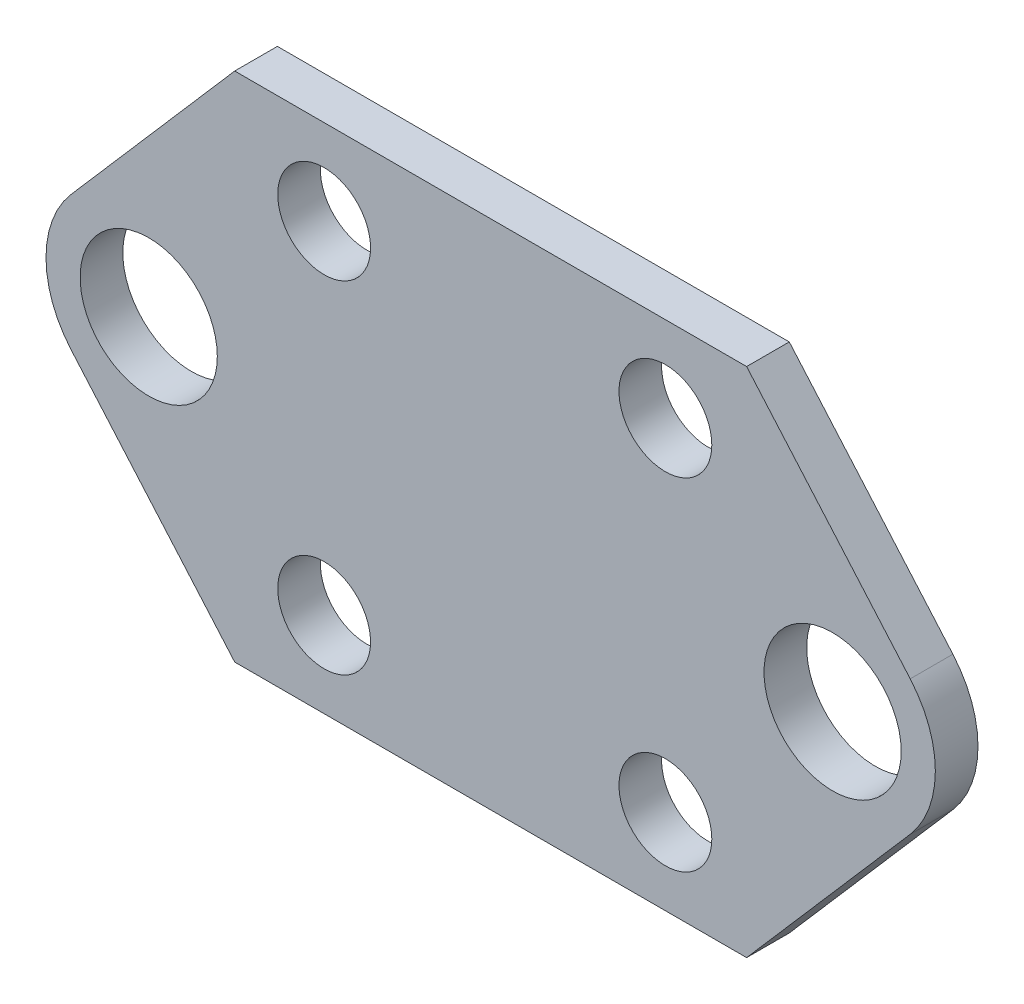
from build123d import *

# Parameters (mm, degrees)
CROQUIS1_R              = 1.7272
CROQUIS1_R_2            = 2.5527
SALIENTE_EXTRUIR1_DEPTH = 0.79375


with BuildPart() as part:
    # Croquis1 → Saliente-Extruir1 (new, symmetric)
    with BuildSketch(Plane.XY):
        with BuildLine():
            ThreePointArc((-15.613365943, 2.50453349), (-16.5481, 0), (-15.613365943, -2.50453349))
            Line((-15.613365943, -2.50453349), (-9.525, -9.525))
            Line((-9.525, -9.525), (9.525, -9.525))
            Line((9.525, -9.525), (15.613365943, -2.50453349))
            ThreePointArc((15.613365943, -2.50453349), (16.5481, 0), (15.613365943, 2.50453349))
            Line((15.613365943, 2.50453349), (9.525, 9.525))
            Line((9.525, 9.525), (-9.525, 9.525))
            Line((-9.525, 9.525), (-15.613365943, 2.50453349))
        make_face()
        with Locations((-6.1976, -6.35)):
            Circle(CROQUIS1_R, mode=Mode.SUBTRACT)
        with Locations((6.5024, -6.35)):
            Circle(CROQUIS1_R, mode=Mode.SUBTRACT)
        with Locations((-12.7254, 0)):
            Circle(CROQUIS1_R_2, mode=Mode.SUBTRACT)
        with Locations((-6.1976, 6.35)):
            Circle(CROQUIS1_R, mode=Mode.SUBTRACT)
        with Locations((6.5024, 6.35)):
            Circle(CROQUIS1_R, mode=Mode.SUBTRACT)
        with Locations((12.7254, 0)):
            Circle(CROQUIS1_R_2, mode=Mode.SUBTRACT)
    extrude(amount=SALIENTE_EXTRUIR1_DEPTH, both=True)


solid = part.part
